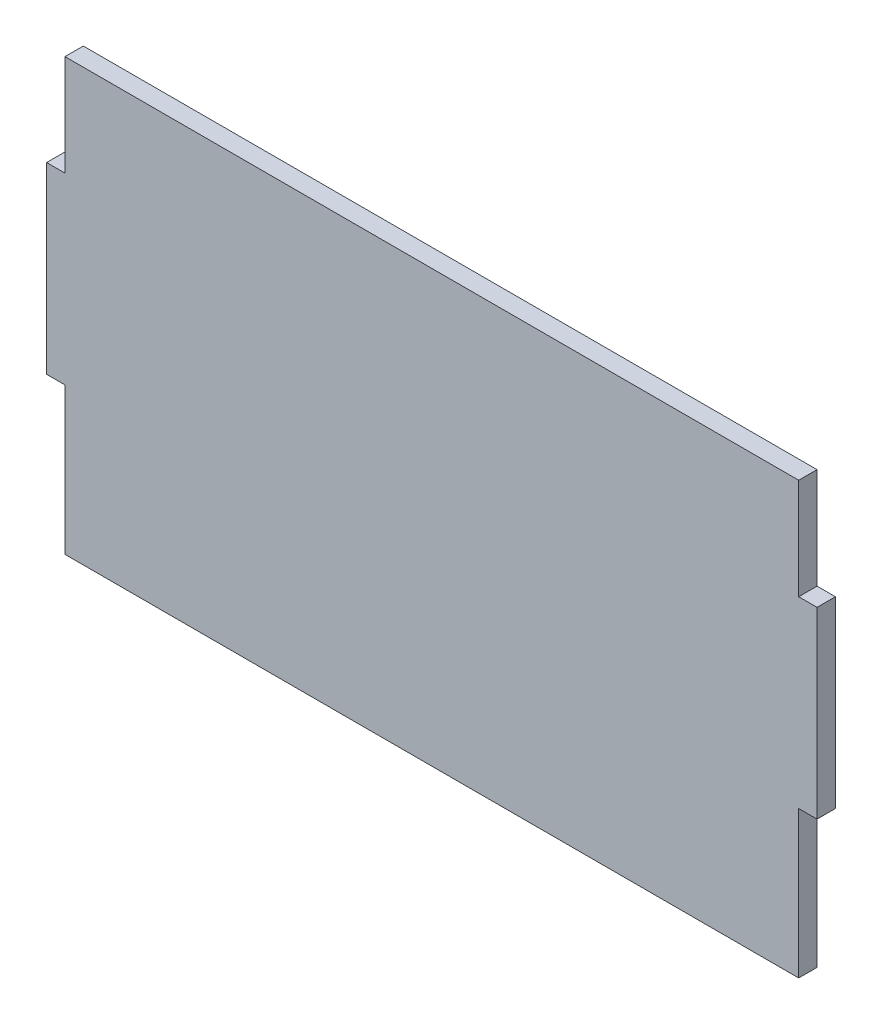
from build123d import *

# Parameters (mm, degrees)
SKETCH_1_W      = 2
SKETCH_1_H      = 20
SKETCH_1_W_2    = 80
SKETCH_1_H_2    = 47
EXTRUDE_1_DEPTH = 2


with BuildPart() as part:
    # Эскиз1 → Бобышка-Вытянуть1 (new body)
    with BuildSketch(Plane.XY):
        with Locations((81, 26)):
            Rectangle(SKETCH_1_W, SKETCH_1_H)
        with Locations((40, 23.5)):
            Rectangle(SKETCH_1_W_2, SKETCH_1_H_2)
        with Locations((-1, 26)):
            Rectangle(SKETCH_1_W, SKETCH_1_H)
    extrude(amount=EXTRUDE_1_DEPTH)


solid = part.part
